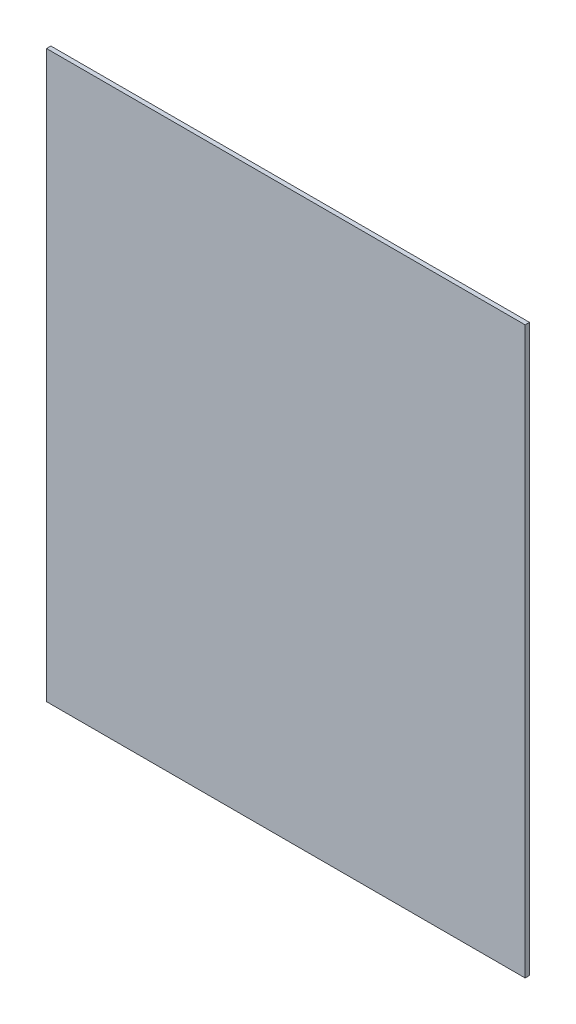
from build123d import *

# Parameters (mm, degrees)
SKETCH1_W           = 330
SKETCH1_H           = 390
BOSS_EXTRUDE1_DEPTH = 3


with BuildPart() as part:
    # Sketch1 → Boss-Extrude1 (new body)
    with BuildSketch(Plane.XY):
        with Locations((165, 195)):
            Rectangle(SKETCH1_W, SKETCH1_H)
    extrude(amount=BOSS_EXTRUDE1_DEPTH)


solid = part.part
